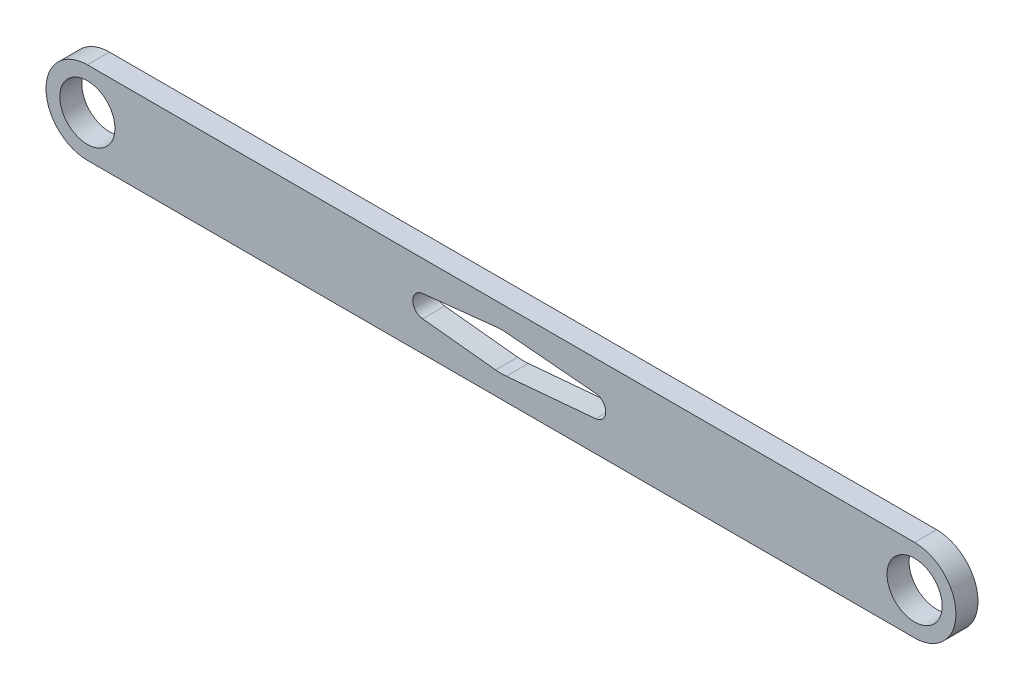
from build123d import *

# Parameters (mm, degrees)
SKETCH1_R           = 5
BOSS_EXTRUDE1_DEPTH = 4


with BuildPart() as part:
    # Sketch1 → Boss-Extrude1 (new body)
    with BuildSketch(Plane.XY):
        with BuildLine():
            Line((75, -7.5), (-75, -7.5))
            ThreePointArc((-75, -7.5), (-82.5, 0), (-75, 7.5))
            Line((-75, 7.5), (75, 7.5))
            ThreePointArc((75, 7.5), (82.5, 0), (75, -7.5))
        make_face()
        with Locations((75, 0)):
            Circle(SKETCH1_R, mode=Mode.SUBTRACT)
        with Locations(Location((-75, 0, 0), (0, 0, 180))):
            Circle(SKETCH1_R, mode=Mode.SUBTRACT)
        with BuildLine():
            Line((-0.965077795, 3.3973761), (-14.211482552, 1.988787352))
            ThreePointArc((-14.211482552, 1.988787352), (-16, 0), (-14.211482552, -1.988787352))
            Line((-14.211482552, -1.988787352), (-0.965077795, -3.3973761))
            ThreePointArc((-0.965077795, -3.3973761), (0.000431807, -3.453017023), (0.966800983, -3.415131426))
            Line((0.966800983, -3.415131426), (17.174893203, -1.992338417))
            ThreePointArc((17.174893203, -1.992338417), (19, 0), (17.174893203, 1.992338417))
            Line((17.174893203, 1.992338417), (0.966800983, 3.415131426))
            ThreePointArc((0.966800983, 3.415131426), (0.000431807, 3.453017023), (-0.965077795, 3.3973761))
        make_face(mode=Mode.SUBTRACT)
    extrude(amount=BOSS_EXTRUDE1_DEPTH)


solid = part.part
